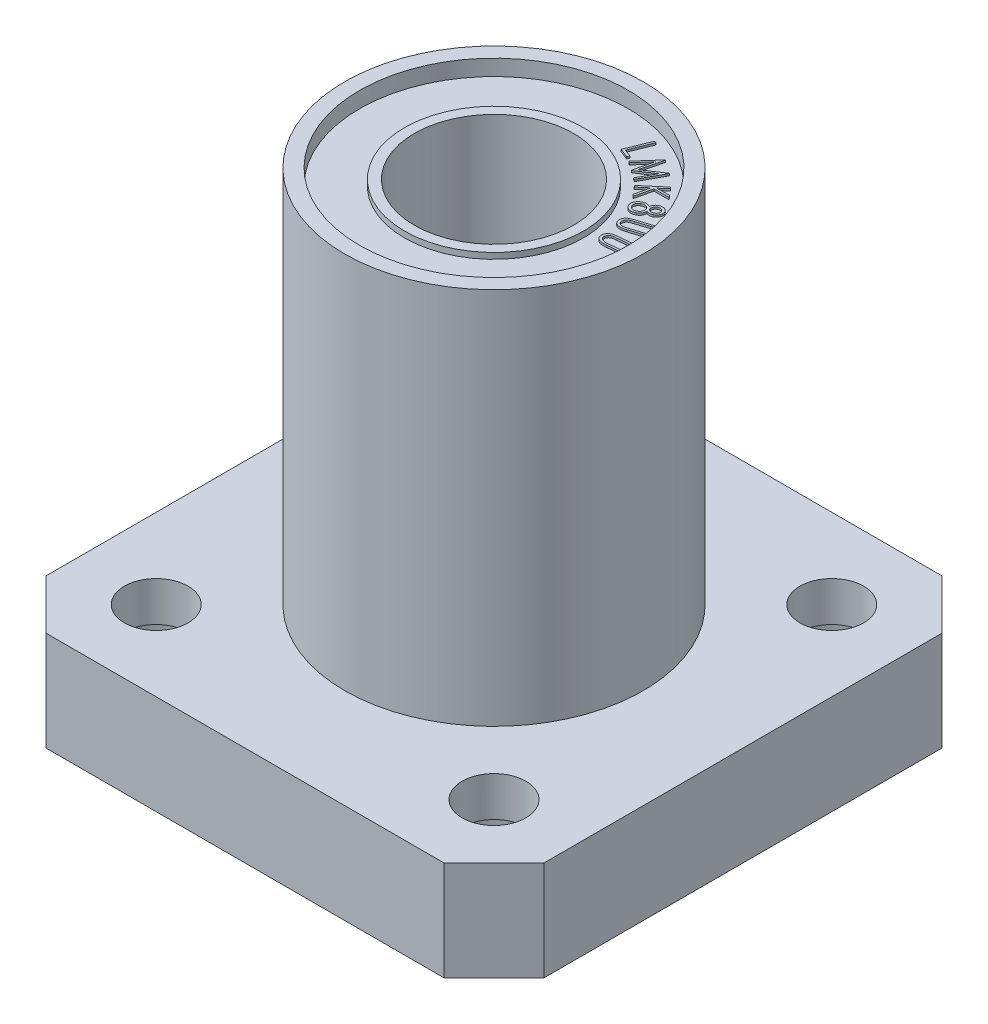
from build123d import *

# Parameters (mm, degrees)
SKETCH1_R           = 7.5
BOSS_EXTRUDE1_DEPTH = 5
SKETCH2_R           = 3
CUT_EXTRUDE1_DEPTH  = 3
CUT_EXTRUDE2_REACH  = 19.93
SKETCH3_R           = 1.6
BOSS_EXTRUDE2_DEPTH = 0.1
BOSS_EXTRUDE3_DEPTH = 0.1


with BuildPart() as part:
    # Sketch1 → Boss-Extrude1 (new body)
    with BuildSketch(Plane(origin=(0, 0, 0), x_dir=(1, 0, 0), z_dir=(0, 1, 0))):
        Polygon((-12.5, 10), (-10, 12.5), (10, 12.5), (12.5, 10), (12.5, -10), (10, -12.5), (-10, -12.5), (-12.5, -10), align=None)
        with Locations(Location((0, 0, 0), (0, 0, 270))):
            Circle(SKETCH1_R, mode=Mode.SUBTRACT)
    extrude(amount=BOSS_EXTRUDE1_DEPTH)

    # Sketch2 → Cut-Extrude1 (cut)
    with BuildSketch(Plane.XZ):
        with Locations(Location((-8.485281374, 8.485281374, 0), (0, 0, 270))):
            Circle(SKETCH2_R)
        with Locations(Location((8.485281374, 8.485281374, 0), (0, 0, 270))):
            Circle(SKETCH2_R)
        with Locations(Location((8.485281374, -8.485281374, 0), (0, 0, 270))):
            Circle(SKETCH2_R)
        with Locations(Location((-8.485281374, -8.485281374, 0), (0, 0, 270))):
            Circle(SKETCH2_R)
    extrude(amount=-CUT_EXTRUDE1_DEPTH, mode=Mode.SUBTRACT)

    # Sketch3 → Cut-Extrude2 (cut, up to next)
    with BuildSketch(Plane.XZ.offset(-3), mode=Mode.PRIVATE) as cut_extrude2_sk1:
        with Locations(Location((-8.485281374, 8.485281374, 0), (0, 0, 270))):
            Circle(SKETCH3_R)
    cut_extrude2_tool1 = extrude(cut_extrude2_sk1.sketch, amount=-CUT_EXTRUDE2_REACH, mode=Mode.PRIVATE) & part.part
    # Sketch3 → Cut-Extrude2 (cut, up to next)
    with BuildSketch(Plane.XZ.offset(-3), mode=Mode.PRIVATE) as cut_extrude2_sk2:
        with Locations(Location((8.485281374, 8.485281374, 0), (0, 0, 270))):
            Circle(SKETCH3_R)
    cut_extrude2_tool2 = extrude(cut_extrude2_sk2.sketch, amount=-CUT_EXTRUDE2_REACH, mode=Mode.PRIVATE) & part.part
    # Sketch3 → Cut-Extrude2 (cut, up to next)
    with BuildSketch(Plane.XZ.offset(-3), mode=Mode.PRIVATE) as cut_extrude2_sk3:
        with Locations(Location((8.485281374, -8.485281374, 0), (0, 0, 270))):
            Circle(SKETCH3_R)
    cut_extrude2_tool3 = extrude(cut_extrude2_sk3.sketch, amount=-CUT_EXTRUDE2_REACH, mode=Mode.PRIVATE) & part.part
    # Sketch3 → Cut-Extrude2 (cut, up to next)
    with BuildSketch(Plane.XZ.offset(-3), mode=Mode.PRIVATE) as cut_extrude2_sk4:
        with Locations(Location((-8.485281374, -8.485281374, 0), (0, 0, 270))):
            Circle(SKETCH3_R)
    cut_extrude2_tool4 = extrude(cut_extrude2_sk4.sketch, amount=-CUT_EXTRUDE2_REACH, mode=Mode.PRIVATE) & part.part
    add(cut_extrude2_tool1.solids().sort_by_distance((-8.485281, 3, 8.485281))[0], mode=Mode.SUBTRACT)
    add(cut_extrude2_tool2.solids().sort_by_distance((8.485281, 3, 8.485281))[0], mode=Mode.SUBTRACT)
    add(cut_extrude2_tool3.solids().sort_by_distance((8.485281, 3, -8.485281))[0], mode=Mode.SUBTRACT)
    add(cut_extrude2_tool4.solids().sort_by_distance((-8.485281, 3, -8.485281))[0], mode=Mode.SUBTRACT)

    # Sketch5 → Revolve1 (revolve)
    with BuildSketch(Plane.XY, mode=Mode.PRIVATE) as revolve1_sk:
        Polygon((4, 23.5), (4, 0.5), (4.5, 0.5), (4.5, 0.8), (6.75, 0.8), (6.75, 0), (7.5, 0), (7.5, 24), (6.75, 24), (6.75, 23.2), (4.5, 23.2), (4.5, 23.5), align=None)
    revolve(revolve1_sk.sketch.rotate(Axis((0, 25.2, 0), (0, -1, 0)), 90), axis=Axis((0, 25.2, 0), (0, -1, 0)))

    # Sketch7 → Boss-Extrude2 (add)
    # profile 1 of 6: a face of its own
    with BuildSketch(Plane(origin=(0, 0.8, 0), x_dir=(-1, 0, 0), z_dir=(0, -1, 0))):
        with BuildLine():
            Line((6.22084145, 0.902349941), (6.229956033, 0.801829108))
            Line((6.229956033, 0.801829108), (5.449487283, 0.730735358))
            add(Edge.make_bspline(
                [(5.449487283, 0.730735358), (5.438464185, 0.729682499), (5.417458447, 0.727676159), (5.387568956, 0.72499647), (5.361054179, 0.721856021), (5.337803578, 0.719893531), (5.317996479, 0.716952125), (5.301359475, 0.71512403), (5.28800597, 0.712986288), (5.280214442, 0.711562123), (5.276831033, 0.710943691)],
                knots=[0, 0, 0, 0, 1.528794766, 2.913288311, 4.14278235, 5.214831381, 6.133494473, 6.906463408, 7.525140423, 8, 8, 8, 8], degree=3))
            add(Edge.make_bspline(
                [(5.276831033, 0.710943691), (5.264711031, 0.708381663), (5.241251219, 0.703422532), (5.208203955, 0.692744228), (5.178478962, 0.679902443), (5.151727017, 0.66513354), (5.127990599, 0.647025429), (5.107103426, 0.625413825), (5.088487928, 0.600509362), (5.072933891, 0.572684668), (5.060523576, 0.543439113), (5.052029333, 0.513826734), (5.047772829, 0.484317373), (5.048745054, 0.464858085), (5.049226866, 0.455214524)],
                knots=[0, 0, 0, 0, 1.180771811, 2.285534731, 3.30513495, 4.265194721, 5.19239267, 6.140746146, 7.122544808, 8.149344855, 9.17330451, 10.145528868, 11.080968084, 12, 12, 12, 12], degree=3))
            add(Edge.make_bspline(
                [(5.049226866, 0.455214524), (5.050255353, 0.446995018), (5.052315784, 0.430528385), (5.060384652, 0.406799568), (5.070662854, 0.383494621), (5.084855347, 0.361578497), (5.101720542, 0.340955516), (5.121411941, 0.322431069), (5.143444309, 0.305966778), (5.167812591, 0.291470264), (5.194764277, 0.279699251), (5.223888715, 0.269653425), (5.255387476, 0.262139131), (5.277320353, 0.259109445), (5.288549783, 0.257558274)],
                knots=[0, 0, 0, 0, 0.88425557, 1.771482618, 2.669440886, 3.604911459, 4.555253855, 5.514633564, 6.490025224, 7.493715192, 8.541612283, 9.631490184, 10.787344957, 12, 12, 12, 12], degree=3))
            add(Edge.make_bspline(
                [(5.288549783, 0.257558274), (5.293234829, 0.257172074), (5.303719502, 0.256307795), (5.321100953, 0.255847477), (5.341766528, 0.256234487), (5.365641491, 0.257005327), (5.392724839, 0.258357201), (5.422946379, 0.260111912), (5.456353831, 0.262836685), (5.479696518, 0.264840827), (5.4919352, 0.265891608)],
                knots=[0, 0, 0, 0, 0.553614757, 1.238935511, 2.046705208, 2.987823637, 4.052359623, 5.240514265, 6.55318855, 8, 8, 8, 8], degree=3))
            Line((5.4919352, 0.265891608), (6.27240395, 0.336985358))
            Line((6.27240395, 0.336985358), (6.281518533, 0.236464524))
            Line((6.281518533, 0.236464524), (5.501049783, 0.165370774))
            add(Edge.make_bspline(
                [(5.501049783, 0.165370774), (5.486992499, 0.164166813), (5.45950586, 0.161812669), (5.419206301, 0.159635363), (5.380928063, 0.157813809), (5.34462415, 0.157739802), (5.310321467, 0.158113977), (5.278006974, 0.159661158), (5.247687471, 0.162258939), (5.21019085, 0.166929646), (5.16549476, 0.176508251), (5.114764546, 0.195618884), (5.066711327, 0.221224617), (5.02985678, 0.248283395), (5.002640779, 0.272770939), (4.984484349, 0.292737047), (4.968667346, 0.31401394), (4.955430457, 0.336490617), (4.944190767, 0.360100944), (4.936167199, 0.385223319), (4.929547918, 0.41135955), (4.927572793, 0.429396115), (4.926570616, 0.438547858)],
                knots=[0, 0, 0, 0, 1.186153523, 2.319322335, 3.393091263, 4.407605337, 5.371114419, 6.277183973, 7.126946973, 7.929015677, 9.453698066, 10.957130468, 12.472209898, 14.018143059, 14.787950398, 15.547447663, 16.283146828, 17.012884695, 17.737752096, 18.47630569, 19.22687838, 20, 20, 20, 20], degree=3))
            add(Edge.make_bspline(
                [(4.926570616, 0.438547858), (4.925848983, 0.448527196), (4.924425049, 0.468218529), (4.925787292, 0.497383615), (4.928552896, 0.525785045), (4.934888297, 0.553127008), (4.942711732, 0.579843745), (4.953628229, 0.605461459), (4.966585185, 0.630269743), (4.982089622, 0.653944991), (4.999339624, 0.676557973), (5.018783342, 0.697380346), (5.039680806, 0.716802903), (5.062327478, 0.734495226), (5.086699636, 0.750396929), (5.112618447, 0.764778085), (5.140162256, 0.777629328), (5.159496002, 0.784533492), (5.16927895, 0.788027024)],
                knots=[0, 0, 0, 0, 1.040328382, 2.052786645, 3.034467863, 4.005533287, 4.968623633, 5.928318322, 6.898164317, 7.877931518, 8.869950425, 9.854454241, 10.838958057, 11.836514772, 12.841285928, 13.864409115, 14.91938305, 16, 16, 16, 16], degree=3))
            add(Edge.make_bspline(
                [(5.16927895, 0.788027024), (5.176115306, 0.790185256), (5.190884015, 0.794847725), (5.215260831, 0.800694626), (5.243407834, 0.806387398), (5.275377585, 0.81179533), (5.311175206, 0.816891959), (5.350723809, 0.82225597), (5.39426294, 0.826734218), (5.424573117, 0.82970673), (5.4403727, 0.831256191)],
                knots=[0, 0, 0, 0, 0.625503873, 1.351287862, 2.186286463, 3.131603887, 4.180501471, 5.341961439, 6.614462024, 8, 8, 8, 8], degree=3))
            Line((5.4403727, 0.831256191), (6.22084145, 0.902349941))
        make_face()
    # profile 2 of 6: a face of its own
    with BuildSketch(Plane(origin=(0, 0.8, 0), x_dir=(-1, 0, 0), z_dir=(0, -1, 0))):
        with BuildLine():
            Line((5.875897339, 2.22233005), (5.906366089, 2.126496717))
            Line((5.906366089, 2.126496717), (5.162095256, 1.889257133))
            add(Edge.make_bspline(
                [(5.162095256, 1.889257133), (5.151584215, 1.88589489), (5.131582296, 1.87949673), (5.10325225, 1.870039151), (5.077937932, 1.861781254), (5.055794525, 1.854246229), (5.036896304, 1.847486676), (5.021076706, 1.84172566), (5.00847353, 1.836895099), (5.001151679, 1.83380332), (4.998032756, 1.8324863)],
                knots=[0, 0, 0, 0, 1.525191931, 2.902354534, 4.127764905, 5.205237062, 6.134916989, 6.901607016, 7.532112379, 8, 8, 8, 8], degree=3))
            add(Edge.make_bspline(
                [(4.998032756, 1.8324863), (4.986831561, 1.82737218), (4.965224289, 1.817506965), (4.935341377, 1.80026622), (4.909189053, 1.781578304), (4.88658173, 1.761271715), (4.867294208, 1.738756951), (4.851825089, 1.713193449), (4.838761568, 1.685091401), (4.829774145, 1.654515167), (4.824096487, 1.623336583), (4.82201257, 1.592632364), (4.824492636, 1.563094803), (4.829448493, 1.544325515), (4.831886923, 1.535090467)],
                knots=[0, 0, 0, 0, 1.179634477, 2.275532612, 3.300685208, 4.254852087, 5.181604681, 6.130497971, 7.109582763, 8.143910145, 9.175255446, 10.14206896, 11.085842548, 12, 12, 12, 12], degree=3))
            add(Edge.make_bspline(
                [(4.831886923, 1.535090467), (4.834679703, 1.527253185), (4.840232553, 1.511670419), (4.852986684, 1.490181983), (4.868059839, 1.469803804), (4.886628439, 1.45158872), (4.907392887, 1.4350815), (4.930471134, 1.421296052), (4.955441655, 1.409972669), (4.982383054, 1.401470718), (5.011160059, 1.395401333), (5.041706982, 1.392489698), (5.074037119, 1.391807477), (5.096045013, 1.393732162), (5.107407756, 1.394725883)],
                knots=[0, 0, 0, 0, 0.890821268, 1.771208317, 2.669159955, 3.604454335, 4.552967615, 5.509859667, 6.481196019, 7.48866292, 8.535452667, 9.631005098, 10.776880757, 12, 12, 12, 12], degree=3))
            add(Edge.make_bspline(
                [(5.107407756, 1.394725883), (5.112107419, 1.39525927), (5.122528245, 1.396441977), (5.139458316, 1.400207623), (5.159523734, 1.404378814), (5.182416624, 1.410674414), (5.208508801, 1.417596548), (5.237636264, 1.42587972), (5.269572395, 1.43592143), (5.291868968, 1.442905224), (5.303501506, 1.4465488)],
                knots=[0, 0, 0, 0, 0.558640481, 1.238704943, 2.047699153, 2.98084938, 4.043522455, 5.238550154, 6.559300155, 8, 8, 8, 8], degree=3))
            Line((5.303501506, 1.4465488), (6.047772339, 1.683788383))
            Line((6.047772339, 1.683788383), (6.078241089, 1.588215467))
            Line((6.078241089, 1.588215467), (5.333970256, 1.350975883))
            add(Edge.make_bspline(
                [(5.333970256, 1.350975883), (5.320531418, 1.346756425), (5.294248528, 1.338504257), (5.25554338, 1.327322114), (5.218492362, 1.317557063), (5.183068426, 1.309674051), (5.149540847, 1.302447722), (5.117747197, 1.296947297), (5.087674301, 1.293078487), (5.050220153, 1.289418003), (5.004724802, 1.289283173), (4.951269085, 1.296674586), (4.899145345, 1.311401079), (4.85731544, 1.32952358), (4.825713304, 1.347524946), (4.803836872, 1.363078052), (4.784048877, 1.38026508), (4.766131779, 1.399103702), (4.750494936, 1.419901712), (4.736552777, 1.442267973), (4.725137686, 1.466669715), (4.71907408, 1.483734832), (4.716001506, 1.492382133)],
                knots=[0, 0, 0, 0, 1.188199745, 2.323811327, 3.398356167, 4.419789937, 5.38488964, 6.291399462, 7.140645276, 7.942173477, 9.465298691, 10.965884116, 12.479704291, 14.02104498, 14.798529993, 15.544225714, 16.281314601, 17.006522459, 17.73294931, 18.472688755, 19.22607503, 20, 20, 20, 20], degree=3))
            add(Edge.make_bspline(
                [(4.716001506, 1.492382133), (4.713112224, 1.501969044), (4.707444669, 1.520774531), (4.702443952, 1.54943931), (4.699374332, 1.577635937), (4.699267069, 1.605610638), (4.70111265, 1.633288958), (4.70632146, 1.660515077), (4.713536463, 1.687486273), (4.7234787, 1.713949621), (4.735647782, 1.739666401), (4.750065805, 1.764149059), (4.766216734, 1.787503059), (4.784636192, 1.809432522), (4.804827771, 1.830256267), (4.827252111, 1.849597466), (4.851371535, 1.867893108), (4.86869346, 1.878792958), (4.877459839, 1.884309217)],
                knots=[0, 0, 0, 0, 1.044353835, 2.048582916, 3.032323801, 4.001981994, 4.965267775, 5.92329655, 6.890538172, 7.876904983, 8.869992292, 9.856900091, 10.839805882, 11.830658089, 12.843152904, 13.864409527, 14.919208139, 16, 16, 16, 16], degree=3))
            add(Edge.make_bspline(
                [(4.877459839, 1.884309217), (4.883588944, 1.887844491), (4.896949639, 1.895550954), (4.919343795, 1.906560891), (4.94546869, 1.918331092), (4.975454831, 1.93038441), (5.009062398, 1.943525075), (5.046535317, 1.956929135), (5.08774931, 1.971063971), (5.116591071, 1.980283996), (5.131626506, 1.985090467)],
                knots=[0, 0, 0, 0, 0.619832187, 1.351157898, 2.185222956, 3.130146418, 4.182446723, 5.346937862, 6.616938003, 8, 8, 8, 8], degree=3))
            Line((5.131626506, 1.985090467), (5.875897339, 2.22233005))
        make_face()
    # profile 3 of 6: a face of its own
    with BuildSketch(Plane(origin=(0, 0.8, 0), x_dir=(-1, 0, 0), z_dir=(0, -1, 0))):
        with BuildLine():
            add(Edge.make_bspline(
                [(5.03623582, 2.660004229), (5.034810644, 2.640495402), (5.032070242, 2.602982791), (5.020296164, 2.54959207), (5.003724531, 2.50118196), (4.980571945, 2.45812066), (4.952240996, 2.419462272), (4.918541977, 2.384836149), (4.880030786, 2.353027275), (4.851067975, 2.33559708), (4.83623582, 2.326670896)],
                knots=[0, 0, 0, 0, 1.148912268, 2.209189684, 3.205302314, 4.148436118, 5.072409288, 6.014644783, 6.983278996, 8, 8, 8, 8], degree=3))
            add(Edge.make_bspline(
                [(4.83623582, 2.326670896), (4.825456511, 2.32088647), (4.804057921, 2.309403491), (4.771100267, 2.294877397), (4.737834, 2.283092366), (4.704414366, 2.273921985), (4.670806, 2.267433955), (4.636953984, 2.263395016), (4.602887149, 2.262411052), (4.580155311, 2.26358423), (4.568787903, 2.264170896)],
                knots=[0, 0, 0, 0, 1.052842317, 2.090054439, 3.096914797, 4.088546547, 5.070472966, 6.040958631, 7.020351043, 8, 8, 8, 8], degree=3))
            add(Edge.make_bspline(
                [(4.568787903, 2.264170896), (4.555183505, 2.265637751), (4.528540204, 2.26851049), (4.490236256, 2.27880957), (4.454178982, 2.292572047), (4.421250646, 2.311846386), (4.390258409, 2.334474365), (4.36251715, 2.362298595), (4.33655309, 2.393782821), (4.322389051, 2.417606561), (4.31514207, 2.429795896)],
                knots=[0, 0, 0, 0, 1.036248287, 2.029422864, 2.998858943, 3.954222451, 4.914066478, 5.900981259, 6.926044263, 8, 8, 8, 8], degree=3))
            add(Edge.make_bspline(
                [(4.31514207, 2.429795896), (4.308715558, 2.441910352), (4.296233204, 2.465440525), (4.282319126, 2.501969584), (4.273155726, 2.53807219), (4.268237545, 2.57382092), (4.268334156, 2.609278065), (4.272744649, 2.644471216), (4.281906995, 2.679340668), (4.296002607, 2.713188089), (4.31278608, 2.745933257), (4.331811663, 2.777048802), (4.353036504, 2.806087032), (4.376207048, 2.833148739), (4.40127539, 2.85833793), (4.428567897, 2.881260474), (4.457634232, 2.902487652), (4.478403537, 2.91476995), (4.488839986, 2.920941729)],
                knots=[0, 0, 0, 0, 1.12686841, 2.188741134, 3.204984959, 4.184230422, 5.147871993, 6.112042166, 7.093730095, 8.102450464, 9.120822918, 10.117346724, 11.098203858, 12.0752876, 13.044386251, 14.016844007, 15.003476194, 16, 16, 16, 16], degree=3))
            add(Edge.make_bspline(
                [(4.488839986, 2.920941729), (4.504465194, 2.929129175), (4.535061547, 2.945161344), (4.583185791, 2.962466036), (4.631755081, 2.973239198), (4.67270441, 2.977037365), (4.705634364, 2.976703635), (4.730802962, 2.974634443), (4.756317699, 2.970456803), (4.782194657, 2.964067514), (4.808531869, 2.955963494), (4.835433328, 2.946058218), (4.862715969, 2.934094207), (4.880726581, 2.924856267), (4.889881653, 2.920160479)],
                knots=[0, 0, 0, 0, 1.507774505, 2.952434298, 4.359598713, 5.754007683, 6.45952714, 7.17490471, 7.912299031, 8.668778663, 9.453349823, 10.268633804, 11.119919897, 12, 12, 12, 12], degree=3))
            add(Edge.make_bspline(
                [(4.889881653, 2.920160479), (4.891318665, 2.934633538), (4.894138785, 2.963036755), (4.904900056, 3.003946751), (4.919953058, 3.042385607), (4.9401818, 3.077966132), (4.964747817, 3.110307673), (4.992430769, 3.139863925), (5.023993573, 3.165613545), (5.047174149, 3.1798772), (5.05889207, 3.187087563)],
                knots=[0, 0, 0, 0, 1.057604441, 2.075537024, 3.068516095, 4.05635199, 5.044915603, 6.019621161, 6.998906665, 8, 8, 8, 8], degree=3))
            add(Edge.make_bspline(
                [(5.05889207, 3.187087563), (5.071343698, 3.193466157), (5.096244073, 3.206221868), (5.136257039, 3.219996105), (5.178224763, 3.229060104), (5.221522084, 3.233708571), (5.265074483, 3.23364889), (5.307356174, 3.227903661), (5.347914065, 3.216923042), (5.385951059, 3.200222995), (5.421092781, 3.178955139), (5.452439529, 3.153521931), (5.479572874, 3.123871892), (5.493529178, 3.101140934), (5.500558736, 3.089691729)],
                knots=[0, 0, 0, 0, 1.004548173, 2.00886383, 3.030699952, 4.084842225, 5.133004105, 6.152991059, 7.14286268, 8.143139466, 9.128597098, 10.086433144, 11.036168305, 12, 12, 12, 12], degree=3))
            add(Edge.make_bspline(
                [(5.500558736, 3.089691729), (5.506525021, 3.078056222), (5.518358125, 3.054979188), (5.528864415, 3.017256556), (5.533873796, 2.978214847), (5.532883929, 2.938073504), (5.52684857, 2.897783985), (5.514507127, 2.858393157), (5.49721647, 2.820020856), (5.474583281, 2.783457334), (5.447931881, 2.749144633), (5.41750065, 2.718357627), (5.384062067, 2.690789853), (5.359354244, 2.675856887), (5.346912903, 2.668337563)],
                knots=[0, 0, 0, 0, 0.945352338, 1.874944359, 2.819668819, 3.788436124, 4.774926252, 5.76171708, 6.769451784, 7.816857136, 8.86991237, 9.910630415, 10.947921905, 12, 12, 12, 12], degree=3))
            add(Edge.make_bspline(
                [(5.346912903, 2.668337563), (5.334301419, 2.661672185), (5.309610511, 2.648622631), (5.270729222, 2.63496993), (5.231891133, 2.625804654), (5.19281449, 2.622163693), (5.153573509, 2.623728151), (5.114345766, 2.630717589), (5.074752854, 2.64242438), (5.049304353, 2.654039522), (5.03623582, 2.660004229)],
                knots=[0, 0, 0, 0, 1.05368983, 2.062926098, 3.037825414, 3.998607814, 4.955952238, 5.933300523, 6.938690664, 8, 8, 8, 8], degree=3))
        make_face()
        with BuildLine():
            add(Edge.make_bspline(
                [(5.388839986, 3.032139646), (5.385299036, 3.038022093), (5.378372593, 3.04952873), (5.36633946, 3.065429433), (5.352603668, 3.079098063), (5.338118151, 3.091718127), (5.321646971, 3.101582908), (5.304566428, 3.110775357), (5.285796475, 3.117366138), (5.259662868, 3.124293381), (5.225999742, 3.128460407), (5.18557819, 3.125762196), (5.145768542, 3.115639449), (5.121191006, 3.103120355), (5.108631653, 3.096722979)],
                knots=[0, 0, 0, 0, 0.771371265, 1.508876917, 2.233168167, 2.946338218, 3.660841298, 4.385066856, 5.122637017, 5.889244203, 7.422241339, 8.908179276, 10.420050441, 12, 12, 12, 12], degree=3))
            add(Edge.make_bspline(
                [(5.108631653, 3.096722979), (5.096629984, 3.089297696), (5.072839874, 3.074579049), (5.043586106, 3.044008908), (5.018751265, 3.009074614), (5.003911608, 2.97573274), (4.994866349, 2.947931403), (4.990156268, 2.927194385), (4.987307294, 2.906963249), (4.987569684, 2.887221647), (4.989147241, 2.868052215), (4.993509845, 2.849486056), (4.99962067, 2.831280652), (5.005605964, 2.819915975), (5.008631653, 2.814170896)],
                knots=[0, 0, 0, 0, 1.533588379, 3.039930189, 4.576467526, 6.190619256, 6.996055201, 7.763185412, 8.507722715, 9.217812041, 9.91213595, 10.601211289, 11.292883492, 12, 12, 12, 12], degree=3))
            add(Edge.make_bspline(
                [(5.008631653, 2.814170896), (5.013065488, 2.807030753), (5.021885548, 2.792827138), (5.039770314, 2.774868392), (5.059763342, 2.758640561), (5.083164683, 2.745874314), (5.108347036, 2.735613189), (5.135431437, 2.729452355), (5.163686495, 2.726513078), (5.192868385, 2.727518705), (5.221949365, 2.731267247), (5.249976654, 2.738221574), (5.276727891, 2.747271939), (5.293191715, 2.75596318), (5.301339986, 2.760264646)],
                knots=[0, 0, 0, 0, 0.917455116, 1.825058412, 2.758815138, 3.729157038, 4.731739484, 5.727766818, 6.759660326, 7.834148225, 8.917679667, 9.96435252, 10.992517998, 12, 12, 12, 12], degree=3))
            add(Edge.make_bspline(
                [(5.301339986, 2.760264646), (5.312223508, 2.766996066), (5.33389392, 2.78039914), (5.36125839, 2.807491116), (5.38486426, 2.838435395), (5.399994142, 2.867835987), (5.409569547, 2.892772883), (5.413942158, 2.912248383), (5.416049118, 2.931821999), (5.41581917, 2.951682774), (5.412935005, 2.971730838), (5.407313715, 2.99185303), (5.399451801, 3.012226042), (5.392457767, 3.025350699), (5.388839986, 3.032139646)],
                knots=[0, 0, 0, 0, 1.437759673, 2.86275386, 4.30837682, 5.808940969, 6.570219614, 7.31286018, 8.05058939, 8.78422242, 9.544998239, 10.325634515, 11.133906579, 12, 12, 12, 12], degree=3))
        make_face(mode=Mode.SUBTRACT)
        with BuildLine():
            add(Edge.make_bspline(
                [(4.907589986, 2.755577146), (4.903157587, 2.762981849), (4.894438977, 2.777547033), (4.878629504, 2.797180002), (4.861017149, 2.814508371), (4.841683656, 2.829714063), (4.820375354, 2.842639525), (4.797089274, 2.85287986), (4.772208553, 2.861366487), (4.745817362, 2.867175232), (4.718719474, 2.870787478), (4.691537353, 2.872112213), (4.664694834, 2.871094627), (4.638122707, 2.867646566), (4.611885529, 2.861942372), (4.585882016, 2.85383383), (4.560352672, 2.843073421), (4.543816595, 2.834428108), (4.53545457, 2.830056313)],
                knots=[0, 0, 0, 0, 0.982504826, 1.932604863, 2.862930666, 3.792993479, 4.729452154, 5.694674639, 6.686299875, 7.720622017, 8.7684788, 9.798439894, 10.818088704, 11.82542742, 12.847951186, 13.874152677, 14.924993485, 16, 16, 16, 16], degree=3))
            add(Edge.make_bspline(
                [(4.53545457, 2.830056313), (4.525410624, 2.823938454), (4.505551989, 2.811842378), (4.478429222, 2.789894954), (4.454252767, 2.765006786), (4.432663124, 2.737967982), (4.414948302, 2.708968934), (4.401730139, 2.678642488), (4.393018906, 2.647452314), (4.389033291, 2.615499786), (4.390142734, 2.583268333), (4.396065147, 2.551140401), (4.406321527, 2.519064576), (4.416990683, 2.498924744), (4.422433736, 2.488650063)],
                knots=[0, 0, 0, 0, 1.050454387, 2.076931838, 3.108558678, 4.147166269, 5.163918326, 6.13700278, 7.095277716, 8.049112307, 9.004082566, 9.966057782, 10.962349478, 12, 12, 12, 12], degree=3))
            add(Edge.make_bspline(
                [(4.422433736, 2.488650063), (4.427160858, 2.480923795), (4.436411282, 2.465804393), (4.452321918, 2.444989407), (4.470121236, 2.427041899), (4.489352018, 2.411379277), (4.510201894, 2.398418937), (4.53261272, 2.387771421), (4.556659257, 2.380152881), (4.581846155, 2.374589096), (4.607784266, 2.371968853), (4.633736178, 2.371015744), (4.659514466, 2.372732918), (4.684988809, 2.37623894), (4.710245708, 2.382365567), (4.735133107, 2.390698955), (4.759847344, 2.401192571), (4.775790437, 2.409625306), (4.78389207, 2.413910479)],
                knots=[0, 0, 0, 0, 1.053215978, 2.061020401, 3.039203443, 3.986947229, 4.939519631, 5.888069893, 6.865157925, 7.867281102, 8.883096294, 9.893275294, 10.884658387, 11.884234868, 12.881002469, 13.902772051, 14.934273937, 16, 16, 16, 16], degree=3))
            add(Edge.make_bspline(
                [(4.78389207, 2.413910479), (4.791522303, 2.418476482), (4.806559736, 2.427475022), (4.827627962, 2.443006359), (4.846793147, 2.460186755), (4.864428817, 2.478732306), (4.880074666, 2.498969383), (4.894154685, 2.520539673), (4.906481884, 2.543735891), (4.91704521, 2.568084777), (4.925280228, 2.593109521), (4.931162577, 2.617836632), (4.934046992, 2.642127288), (4.934323094, 2.665874025), (4.932053332, 2.689237489), (4.926760963, 2.712058581), (4.918675676, 2.734351282), (4.911313341, 2.748448008), (4.907589986, 2.755577146)],
                knots=[0, 0, 0, 0, 1.061417744, 2.091809977, 3.119644169, 4.131569755, 5.143442247, 6.169864184, 7.204003688, 8.276549239, 9.33533168, 10.346141727, 11.306586232, 12.249929467, 13.177189198, 14.102534959, 15.040394922, 16, 16, 16, 16], degree=3))
        make_face(mode=Mode.SUBTRACT)
    # profile 4 of 6: a face of its own
    with BuildSketch(Plane(origin=(0, 0.8, 0), x_dir=(-1, 0, 0), z_dir=(0, -1, 0))):
        Polygon((4.57383865, 4.29708848), (4.639984483, 4.21896348), (4.271755317, 3.90646348), (4.899099067, 3.913234314), (4.9871199, 3.80958848), (4.234515733, 3.804380147), (4.029828233, 2.948390564), (3.943890733, 3.049953064), (4.116286567, 3.774692647), (3.658474067, 3.386411397), (3.592328233, 3.464536397), align=None)
    # profile 5 of 6: a face of its own
    with BuildSketch(Plane(origin=(0, 0.8, 0), x_dir=(-1, 0, 0), z_dir=(0, -1, 0))):
        Polygon((2.393817974, 4.378423393), (3.266213808, 5.348735893), (3.279495058, 5.339100476), (2.989651308, 4.237017143), (3.938088808, 4.865923393), (3.951370058, 4.856548393), (3.311265891, 3.71930881), (3.231057558, 3.776860893), (3.692776308, 4.587537976), (2.863609641, 4.040923393), (2.843297141, 4.055506726), (3.096942974, 5.024256726), (2.472463808, 4.321912976), align=None)
    # profile 6 of 6: a face of its own
    with BuildSketch(Plane(origin=(0, 0.8, 0), x_dir=(-1, 0, 0), z_dir=(0, -1, 0))):
        Polygon((2.18878182, 5.894599264), (2.282792237, 5.855536764), (1.83253182, 4.774026348), (2.19112557, 4.624807598), (2.142948487, 4.509182598), (1.69034432, 4.697463848), align=None)
    extrude(amount=BOSS_EXTRUDE2_DEPTH)

    # Sketch8 → Boss-Extrude3 (add)
    # profile 1 of 6: a face of its own
    with BuildSketch(Plane(origin=(0, 23.2, 0), x_dir=(1, 0, 0), z_dir=(0, 1, 0))):
        with BuildLine():
            Line((6.22084145, 0.902349941), (6.229956033, 0.801829108))
            Line((6.229956033, 0.801829108), (5.449487283, 0.730735358))
            add(Edge.make_bspline(
                [(5.449487283, 0.730735358), (5.438464185, 0.729682499), (5.417458447, 0.727676159), (5.387568956, 0.72499647), (5.361054179, 0.721856021), (5.337803578, 0.719893531), (5.317996479, 0.716952125), (5.301359475, 0.71512403), (5.28800597, 0.712986288), (5.280214442, 0.711562123), (5.276831033, 0.710943691)],
                knots=[0, 0, 0, 0, 1.528794766, 2.913288311, 4.14278235, 5.214831381, 6.133494473, 6.906463408, 7.525140423, 8, 8, 8, 8], degree=3))
            add(Edge.make_bspline(
                [(5.276831033, 0.710943691), (5.264711031, 0.708381663), (5.241251219, 0.703422532), (5.208203955, 0.692744228), (5.178478962, 0.679902443), (5.151727017, 0.66513354), (5.127990599, 0.647025429), (5.107103426, 0.625413825), (5.088487928, 0.600509362), (5.072933891, 0.572684668), (5.060523576, 0.543439113), (5.052029333, 0.513826734), (5.047772829, 0.484317373), (5.048745054, 0.464858085), (5.049226866, 0.455214524)],
                knots=[0, 0, 0, 0, 1.180771811, 2.285534731, 3.30513495, 4.265194721, 5.19239267, 6.140746146, 7.122544808, 8.149344855, 9.17330451, 10.145528868, 11.080968084, 12, 12, 12, 12], degree=3))
            add(Edge.make_bspline(
                [(5.049226866, 0.455214524), (5.050255353, 0.446995018), (5.052315784, 0.430528385), (5.060384652, 0.406799568), (5.070662854, 0.383494621), (5.084855347, 0.361578497), (5.101720542, 0.340955516), (5.121411941, 0.322431069), (5.143444309, 0.305966778), (5.167812591, 0.291470264), (5.194764277, 0.279699251), (5.223888715, 0.269653425), (5.255387476, 0.262139131), (5.277320353, 0.259109445), (5.288549783, 0.257558274)],
                knots=[0, 0, 0, 0, 0.88425557, 1.771482618, 2.669440886, 3.604911459, 4.555253855, 5.514633564, 6.490025224, 7.493715192, 8.541612283, 9.631490184, 10.787344957, 12, 12, 12, 12], degree=3))
            add(Edge.make_bspline(
                [(5.288549783, 0.257558274), (5.293234829, 0.257172074), (5.303719502, 0.256307795), (5.321100953, 0.255847477), (5.341766528, 0.256234487), (5.365641491, 0.257005327), (5.392724839, 0.258357201), (5.422946379, 0.260111912), (5.456353831, 0.262836685), (5.479696518, 0.264840827), (5.4919352, 0.265891608)],
                knots=[0, 0, 0, 0, 0.553614757, 1.238935511, 2.046705208, 2.987823637, 4.052359623, 5.240514265, 6.55318855, 8, 8, 8, 8], degree=3))
            Line((5.4919352, 0.265891608), (6.27240395, 0.336985358))
            Line((6.27240395, 0.336985358), (6.281518533, 0.236464524))
            Line((6.281518533, 0.236464524), (5.501049783, 0.165370774))
            add(Edge.make_bspline(
                [(5.501049783, 0.165370774), (5.486992499, 0.164166813), (5.45950586, 0.161812669), (5.419206301, 0.159635363), (5.380928063, 0.157813809), (5.34462415, 0.157739802), (5.310321467, 0.158113977), (5.278006974, 0.159661158), (5.247687471, 0.162258939), (5.21019085, 0.166929646), (5.16549476, 0.176508251), (5.114764546, 0.195618884), (5.066711327, 0.221224617), (5.02985678, 0.248283395), (5.002640779, 0.272770939), (4.984484349, 0.292737047), (4.968667346, 0.31401394), (4.955430457, 0.336490617), (4.944190767, 0.360100944), (4.936167199, 0.385223319), (4.929547918, 0.41135955), (4.927572793, 0.429396115), (4.926570616, 0.438547858)],
                knots=[0, 0, 0, 0, 1.186153523, 2.319322335, 3.393091263, 4.407605337, 5.371114419, 6.277183973, 7.126946973, 7.929015677, 9.453698066, 10.957130468, 12.472209898, 14.018143059, 14.787950398, 15.547447663, 16.283146828, 17.012884695, 17.737752096, 18.47630569, 19.22687838, 20, 20, 20, 20], degree=3))
            add(Edge.make_bspline(
                [(4.926570616, 0.438547858), (4.925848983, 0.448527196), (4.924425049, 0.468218529), (4.925787292, 0.497383615), (4.928552896, 0.525785045), (4.934888297, 0.553127008), (4.942711732, 0.579843745), (4.953628229, 0.605461459), (4.966585185, 0.630269743), (4.982089622, 0.653944991), (4.999339624, 0.676557973), (5.018783342, 0.697380346), (5.039680806, 0.716802903), (5.062327478, 0.734495226), (5.086699636, 0.750396929), (5.112618447, 0.764778085), (5.140162256, 0.777629328), (5.159496002, 0.784533492), (5.16927895, 0.788027024)],
                knots=[0, 0, 0, 0, 1.040328382, 2.052786645, 3.034467863, 4.005533287, 4.968623633, 5.928318322, 6.898164317, 7.877931518, 8.869950425, 9.854454241, 10.838958057, 11.836514772, 12.841285928, 13.864409115, 14.91938305, 16, 16, 16, 16], degree=3))
            add(Edge.make_bspline(
                [(5.16927895, 0.788027024), (5.176115306, 0.790185256), (5.190884015, 0.794847725), (5.215260831, 0.800694626), (5.243407834, 0.806387398), (5.275377585, 0.81179533), (5.311175206, 0.816891959), (5.350723809, 0.82225597), (5.39426294, 0.826734218), (5.424573117, 0.82970673), (5.4403727, 0.831256191)],
                knots=[0, 0, 0, 0, 0.625503873, 1.351287862, 2.186286463, 3.131603887, 4.180501471, 5.341961439, 6.614462024, 8, 8, 8, 8], degree=3))
            Line((5.4403727, 0.831256191), (6.22084145, 0.902349941))
        make_face()
    # profile 2 of 6: a face of its own
    with BuildSketch(Plane(origin=(0, 23.2, 0), x_dir=(1, 0, 0), z_dir=(0, 1, 0))):
        with BuildLine():
            Line((5.875897339, 2.22233005), (5.906366089, 2.126496717))
            Line((5.906366089, 2.126496717), (5.162095256, 1.889257133))
            add(Edge.make_bspline(
                [(5.162095256, 1.889257133), (5.151584215, 1.88589489), (5.131582296, 1.87949673), (5.10325225, 1.870039151), (5.077937932, 1.861781254), (5.055794525, 1.854246229), (5.036896304, 1.847486676), (5.021076706, 1.84172566), (5.00847353, 1.836895099), (5.001151679, 1.83380332), (4.998032756, 1.8324863)],
                knots=[0, 0, 0, 0, 1.525191931, 2.902354534, 4.127764905, 5.205237062, 6.134916989, 6.901607016, 7.532112379, 8, 8, 8, 8], degree=3))
            add(Edge.make_bspline(
                [(4.998032756, 1.8324863), (4.986831561, 1.82737218), (4.965224289, 1.817506965), (4.935341377, 1.80026622), (4.909189053, 1.781578304), (4.88658173, 1.761271715), (4.867294208, 1.738756951), (4.851825089, 1.713193449), (4.838761568, 1.685091401), (4.829774145, 1.654515167), (4.824096487, 1.623336583), (4.82201257, 1.592632364), (4.824492636, 1.563094803), (4.829448493, 1.544325515), (4.831886923, 1.535090467)],
                knots=[0, 0, 0, 0, 1.179634477, 2.275532612, 3.300685208, 4.254852087, 5.181604681, 6.130497971, 7.109582763, 8.143910145, 9.175255446, 10.14206896, 11.085842548, 12, 12, 12, 12], degree=3))
            add(Edge.make_bspline(
                [(4.831886923, 1.535090467), (4.834679703, 1.527253185), (4.840232553, 1.511670419), (4.852986684, 1.490181983), (4.868059839, 1.469803804), (4.886628439, 1.45158872), (4.907392887, 1.4350815), (4.930471134, 1.421296052), (4.955441655, 1.409972669), (4.982383054, 1.401470718), (5.011160059, 1.395401333), (5.041706982, 1.392489698), (5.074037119, 1.391807477), (5.096045013, 1.393732162), (5.107407756, 1.394725883)],
                knots=[0, 0, 0, 0, 0.890821268, 1.771208317, 2.669159955, 3.604454335, 4.552967615, 5.509859667, 6.481196019, 7.48866292, 8.535452667, 9.631005098, 10.776880757, 12, 12, 12, 12], degree=3))
            add(Edge.make_bspline(
                [(5.107407756, 1.394725883), (5.112107419, 1.39525927), (5.122528245, 1.396441977), (5.139458316, 1.400207623), (5.159523734, 1.404378814), (5.182416624, 1.410674414), (5.208508801, 1.417596548), (5.237636264, 1.42587972), (5.269572395, 1.43592143), (5.291868968, 1.442905224), (5.303501506, 1.4465488)],
                knots=[0, 0, 0, 0, 0.558640481, 1.238704943, 2.047699153, 2.98084938, 4.043522455, 5.238550154, 6.559300155, 8, 8, 8, 8], degree=3))
            Line((5.303501506, 1.4465488), (6.047772339, 1.683788383))
            Line((6.047772339, 1.683788383), (6.078241089, 1.588215467))
            Line((6.078241089, 1.588215467), (5.333970256, 1.350975883))
            add(Edge.make_bspline(
                [(5.333970256, 1.350975883), (5.320531418, 1.346756425), (5.294248528, 1.338504257), (5.25554338, 1.327322114), (5.218492362, 1.317557063), (5.183068426, 1.309674051), (5.149540847, 1.302447722), (5.117747197, 1.296947297), (5.087674301, 1.293078487), (5.050220153, 1.289418003), (5.004724802, 1.289283173), (4.951269085, 1.296674586), (4.899145345, 1.311401079), (4.85731544, 1.32952358), (4.825713304, 1.347524946), (4.803836872, 1.363078052), (4.784048877, 1.38026508), (4.766131779, 1.399103702), (4.750494936, 1.419901712), (4.736552777, 1.442267973), (4.725137686, 1.466669715), (4.71907408, 1.483734832), (4.716001506, 1.492382133)],
                knots=[0, 0, 0, 0, 1.188199745, 2.323811327, 3.398356167, 4.419789937, 5.38488964, 6.291399462, 7.140645276, 7.942173477, 9.465298691, 10.965884116, 12.479704291, 14.02104498, 14.798529993, 15.544225714, 16.281314601, 17.006522459, 17.73294931, 18.472688755, 19.22607503, 20, 20, 20, 20], degree=3))
            add(Edge.make_bspline(
                [(4.716001506, 1.492382133), (4.713112224, 1.501969044), (4.707444669, 1.520774531), (4.702443952, 1.54943931), (4.699374332, 1.577635937), (4.699267069, 1.605610638), (4.70111265, 1.633288958), (4.70632146, 1.660515077), (4.713536463, 1.687486273), (4.7234787, 1.713949621), (4.735647782, 1.739666401), (4.750065805, 1.764149059), (4.766216734, 1.787503059), (4.784636192, 1.809432522), (4.804827771, 1.830256267), (4.827252111, 1.849597466), (4.851371535, 1.867893108), (4.86869346, 1.878792958), (4.877459839, 1.884309217)],
                knots=[0, 0, 0, 0, 1.044353835, 2.048582916, 3.032323801, 4.001981994, 4.965267775, 5.92329655, 6.890538172, 7.876904983, 8.869992292, 9.856900091, 10.839805882, 11.830658089, 12.843152904, 13.864409527, 14.919208139, 16, 16, 16, 16], degree=3))
            add(Edge.make_bspline(
                [(4.877459839, 1.884309217), (4.883588944, 1.887844491), (4.896949639, 1.895550954), (4.919343795, 1.906560891), (4.94546869, 1.918331092), (4.975454831, 1.93038441), (5.009062398, 1.943525075), (5.046535317, 1.956929135), (5.08774931, 1.971063971), (5.116591071, 1.980283996), (5.131626506, 1.985090467)],
                knots=[0, 0, 0, 0, 0.619832187, 1.351157898, 2.185222956, 3.130146418, 4.182446723, 5.346937862, 6.616938003, 8, 8, 8, 8], degree=3))
            Line((5.131626506, 1.985090467), (5.875897339, 2.22233005))
        make_face()
    # profile 3 of 6: a face of its own
    with BuildSketch(Plane(origin=(0, 23.2, 0), x_dir=(1, 0, 0), z_dir=(0, 1, 0))):
        with BuildLine():
            add(Edge.make_bspline(
                [(5.03623582, 2.660004229), (5.034810644, 2.640495402), (5.032070242, 2.602982791), (5.020296164, 2.54959207), (5.003724531, 2.50118196), (4.980571945, 2.45812066), (4.952240996, 2.419462272), (4.918541977, 2.384836149), (4.880030786, 2.353027275), (4.851067975, 2.33559708), (4.83623582, 2.326670896)],
                knots=[0, 0, 0, 0, 1.148912268, 2.209189684, 3.205302314, 4.148436118, 5.072409288, 6.014644783, 6.983278996, 8, 8, 8, 8], degree=3))
            add(Edge.make_bspline(
                [(4.83623582, 2.326670896), (4.825456511, 2.32088647), (4.804057921, 2.309403491), (4.771100267, 2.294877397), (4.737834, 2.283092366), (4.704414366, 2.273921985), (4.670806, 2.267433955), (4.636953984, 2.263395016), (4.602887149, 2.262411052), (4.580155311, 2.26358423), (4.568787903, 2.264170896)],
                knots=[0, 0, 0, 0, 1.052842317, 2.090054439, 3.096914797, 4.088546547, 5.070472966, 6.040958631, 7.020351043, 8, 8, 8, 8], degree=3))
            add(Edge.make_bspline(
                [(4.568787903, 2.264170896), (4.555183505, 2.265637751), (4.528540204, 2.26851049), (4.490236256, 2.27880957), (4.454178982, 2.292572047), (4.421250646, 2.311846386), (4.390258409, 2.334474365), (4.36251715, 2.362298595), (4.33655309, 2.393782821), (4.322389051, 2.417606561), (4.31514207, 2.429795896)],
                knots=[0, 0, 0, 0, 1.036248287, 2.029422864, 2.998858943, 3.954222451, 4.914066478, 5.900981259, 6.926044263, 8, 8, 8, 8], degree=3))
            add(Edge.make_bspline(
                [(4.31514207, 2.429795896), (4.308715558, 2.441910352), (4.296233204, 2.465440525), (4.282319126, 2.501969584), (4.273155726, 2.53807219), (4.268237545, 2.57382092), (4.268334156, 2.609278065), (4.272744649, 2.644471216), (4.281906995, 2.679340668), (4.296002607, 2.713188089), (4.31278608, 2.745933257), (4.331811663, 2.777048802), (4.353036504, 2.806087032), (4.376207048, 2.833148739), (4.40127539, 2.85833793), (4.428567897, 2.881260474), (4.457634232, 2.902487652), (4.478403537, 2.91476995), (4.488839986, 2.920941729)],
                knots=[0, 0, 0, 0, 1.12686841, 2.188741134, 3.204984959, 4.184230422, 5.147871993, 6.112042166, 7.093730095, 8.102450464, 9.120822918, 10.117346724, 11.098203858, 12.0752876, 13.044386251, 14.016844007, 15.003476194, 16, 16, 16, 16], degree=3))
            add(Edge.make_bspline(
                [(4.488839986, 2.920941729), (4.504465194, 2.929129175), (4.535061547, 2.945161344), (4.583185791, 2.962466036), (4.631755081, 2.973239198), (4.67270441, 2.977037365), (4.705634364, 2.976703635), (4.730802962, 2.974634443), (4.756317699, 2.970456803), (4.782194657, 2.964067514), (4.808531869, 2.955963494), (4.835433328, 2.946058218), (4.862715969, 2.934094207), (4.880726581, 2.924856267), (4.889881653, 2.920160479)],
                knots=[0, 0, 0, 0, 1.507774505, 2.952434298, 4.359598713, 5.754007683, 6.45952714, 7.17490471, 7.912299031, 8.668778663, 9.453349823, 10.268633804, 11.119919897, 12, 12, 12, 12], degree=3))
            add(Edge.make_bspline(
                [(4.889881653, 2.920160479), (4.891318665, 2.934633538), (4.894138785, 2.963036755), (4.904900056, 3.003946751), (4.919953058, 3.042385607), (4.9401818, 3.077966132), (4.964747817, 3.110307673), (4.992430769, 3.139863925), (5.023993573, 3.165613545), (5.047174149, 3.1798772), (5.05889207, 3.187087563)],
                knots=[0, 0, 0, 0, 1.057604441, 2.075537024, 3.068516095, 4.05635199, 5.044915603, 6.019621161, 6.998906665, 8, 8, 8, 8], degree=3))
            add(Edge.make_bspline(
                [(5.05889207, 3.187087563), (5.071343698, 3.193466157), (5.096244073, 3.206221868), (5.136257039, 3.219996105), (5.178224763, 3.229060104), (5.221522084, 3.233708571), (5.265074483, 3.23364889), (5.307356174, 3.227903661), (5.347914065, 3.216923042), (5.385951059, 3.200222995), (5.421092781, 3.178955139), (5.452439529, 3.153521931), (5.479572874, 3.123871892), (5.493529178, 3.101140934), (5.500558736, 3.089691729)],
                knots=[0, 0, 0, 0, 1.004548173, 2.00886383, 3.030699952, 4.084842225, 5.133004105, 6.152991059, 7.14286268, 8.143139466, 9.128597098, 10.086433144, 11.036168305, 12, 12, 12, 12], degree=3))
            add(Edge.make_bspline(
                [(5.500558736, 3.089691729), (5.506525021, 3.078056222), (5.518358125, 3.054979188), (5.528864415, 3.017256556), (5.533873796, 2.978214847), (5.532883929, 2.938073504), (5.52684857, 2.897783985), (5.514507127, 2.858393157), (5.49721647, 2.820020856), (5.474583281, 2.783457334), (5.447931881, 2.749144633), (5.41750065, 2.718357627), (5.384062067, 2.690789853), (5.359354244, 2.675856887), (5.346912903, 2.668337563)],
                knots=[0, 0, 0, 0, 0.945352338, 1.874944359, 2.819668819, 3.788436124, 4.774926252, 5.76171708, 6.769451784, 7.816857136, 8.86991237, 9.910630415, 10.947921905, 12, 12, 12, 12], degree=3))
            add(Edge.make_bspline(
                [(5.346912903, 2.668337563), (5.334301419, 2.661672185), (5.309610511, 2.648622631), (5.270729222, 2.63496993), (5.231891133, 2.625804654), (5.19281449, 2.622163693), (5.153573509, 2.623728151), (5.114345766, 2.630717589), (5.074752854, 2.64242438), (5.049304353, 2.654039522), (5.03623582, 2.660004229)],
                knots=[0, 0, 0, 0, 1.05368983, 2.062926098, 3.037825414, 3.998607814, 4.955952238, 5.933300523, 6.938690664, 8, 8, 8, 8], degree=3))
        make_face()
        with BuildLine():
            add(Edge.make_bspline(
                [(5.388839986, 3.032139646), (5.385299036, 3.038022093), (5.378372593, 3.04952873), (5.36633946, 3.065429433), (5.352603668, 3.079098063), (5.338118151, 3.091718127), (5.321646971, 3.101582908), (5.304566428, 3.110775357), (5.285796475, 3.117366138), (5.259662868, 3.124293381), (5.225999742, 3.128460407), (5.18557819, 3.125762196), (5.145768542, 3.115639449), (5.121191006, 3.103120355), (5.108631653, 3.096722979)],
                knots=[0, 0, 0, 0, 0.771371265, 1.508876917, 2.233168167, 2.946338218, 3.660841298, 4.385066856, 5.122637017, 5.889244203, 7.422241339, 8.908179276, 10.420050441, 12, 12, 12, 12], degree=3))
            add(Edge.make_bspline(
                [(5.108631653, 3.096722979), (5.096629984, 3.089297696), (5.072839874, 3.074579049), (5.043586106, 3.044008908), (5.018751265, 3.009074614), (5.003911608, 2.97573274), (4.994866349, 2.947931403), (4.990156268, 2.927194385), (4.987307294, 2.906963249), (4.987569684, 2.887221647), (4.989147241, 2.868052215), (4.993509845, 2.849486056), (4.99962067, 2.831280652), (5.005605964, 2.819915975), (5.008631653, 2.814170896)],
                knots=[0, 0, 0, 0, 1.533588379, 3.039930189, 4.576467526, 6.190619256, 6.996055201, 7.763185412, 8.507722715, 9.217812041, 9.91213595, 10.601211289, 11.292883492, 12, 12, 12, 12], degree=3))
            add(Edge.make_bspline(
                [(5.008631653, 2.814170896), (5.013065488, 2.807030753), (5.021885548, 2.792827138), (5.039770314, 2.774868392), (5.059763342, 2.758640561), (5.083164683, 2.745874314), (5.108347036, 2.735613189), (5.135431437, 2.729452355), (5.163686495, 2.726513078), (5.192868385, 2.727518705), (5.221949365, 2.731267247), (5.249976654, 2.738221574), (5.276727891, 2.747271939), (5.293191715, 2.75596318), (5.301339986, 2.760264646)],
                knots=[0, 0, 0, 0, 0.917455116, 1.825058412, 2.758815138, 3.729157038, 4.731739484, 5.727766818, 6.759660326, 7.834148225, 8.917679667, 9.96435252, 10.992517998, 12, 12, 12, 12], degree=3))
            add(Edge.make_bspline(
                [(5.301339986, 2.760264646), (5.312223508, 2.766996066), (5.33389392, 2.78039914), (5.36125839, 2.807491116), (5.38486426, 2.838435395), (5.399994142, 2.867835987), (5.409569547, 2.892772883), (5.413942158, 2.912248383), (5.416049118, 2.931821999), (5.41581917, 2.951682774), (5.412935005, 2.971730838), (5.407313715, 2.99185303), (5.399451801, 3.012226042), (5.392457767, 3.025350699), (5.388839986, 3.032139646)],
                knots=[0, 0, 0, 0, 1.437759673, 2.86275386, 4.30837682, 5.808940969, 6.570219614, 7.31286018, 8.05058939, 8.78422242, 9.544998239, 10.325634515, 11.133906579, 12, 12, 12, 12], degree=3))
        make_face(mode=Mode.SUBTRACT)
        with BuildLine():
            add(Edge.make_bspline(
                [(4.907589986, 2.755577146), (4.903157587, 2.762981849), (4.894438977, 2.777547033), (4.878629504, 2.797180002), (4.861017149, 2.814508371), (4.841683656, 2.829714063), (4.820375354, 2.842639525), (4.797089274, 2.85287986), (4.772208553, 2.861366487), (4.745817362, 2.867175232), (4.718719474, 2.870787478), (4.691537353, 2.872112213), (4.664694834, 2.871094627), (4.638122707, 2.867646566), (4.611885529, 2.861942372), (4.585882016, 2.85383383), (4.560352672, 2.843073421), (4.543816595, 2.834428108), (4.53545457, 2.830056313)],
                knots=[0, 0, 0, 0, 0.982504826, 1.932604863, 2.862930666, 3.792993479, 4.729452154, 5.694674639, 6.686299875, 7.720622017, 8.7684788, 9.798439894, 10.818088704, 11.82542742, 12.847951186, 13.874152677, 14.924993485, 16, 16, 16, 16], degree=3))
            add(Edge.make_bspline(
                [(4.53545457, 2.830056313), (4.525410624, 2.823938454), (4.505551989, 2.811842378), (4.478429222, 2.789894954), (4.454252767, 2.765006786), (4.432663124, 2.737967982), (4.414948302, 2.708968934), (4.401730139, 2.678642488), (4.393018906, 2.647452314), (4.389033291, 2.615499786), (4.390142734, 2.583268333), (4.396065147, 2.551140401), (4.406321527, 2.519064576), (4.416990683, 2.498924744), (4.422433736, 2.488650063)],
                knots=[0, 0, 0, 0, 1.050454387, 2.076931838, 3.108558678, 4.147166269, 5.163918326, 6.13700278, 7.095277716, 8.049112307, 9.004082566, 9.966057782, 10.962349478, 12, 12, 12, 12], degree=3))
            add(Edge.make_bspline(
                [(4.422433736, 2.488650063), (4.427160858, 2.480923795), (4.436411282, 2.465804393), (4.452321918, 2.444989407), (4.470121236, 2.427041899), (4.489352018, 2.411379277), (4.510201894, 2.398418937), (4.53261272, 2.387771421), (4.556659257, 2.380152881), (4.581846155, 2.374589096), (4.607784266, 2.371968853), (4.633736178, 2.371015744), (4.659514466, 2.372732918), (4.684988809, 2.37623894), (4.710245708, 2.382365567), (4.735133107, 2.390698955), (4.759847344, 2.401192571), (4.775790437, 2.409625306), (4.78389207, 2.413910479)],
                knots=[0, 0, 0, 0, 1.053215978, 2.061020401, 3.039203443, 3.986947229, 4.939519631, 5.888069893, 6.865157925, 7.867281102, 8.883096294, 9.893275294, 10.884658387, 11.884234868, 12.881002469, 13.902772051, 14.934273937, 16, 16, 16, 16], degree=3))
            add(Edge.make_bspline(
                [(4.78389207, 2.413910479), (4.791522303, 2.418476482), (4.806559736, 2.427475022), (4.827627962, 2.443006359), (4.846793147, 2.460186755), (4.864428817, 2.478732306), (4.880074666, 2.498969383), (4.894154685, 2.520539673), (4.906481884, 2.543735891), (4.91704521, 2.568084777), (4.925280228, 2.593109521), (4.931162577, 2.617836632), (4.934046992, 2.642127288), (4.934323094, 2.665874025), (4.932053332, 2.689237489), (4.926760963, 2.712058581), (4.918675676, 2.734351282), (4.911313341, 2.748448008), (4.907589986, 2.755577146)],
                knots=[0, 0, 0, 0, 1.061417744, 2.091809977, 3.119644169, 4.131569755, 5.143442247, 6.169864184, 7.204003688, 8.276549239, 9.33533168, 10.346141727, 11.306586232, 12.249929467, 13.177189198, 14.102534959, 15.040394922, 16, 16, 16, 16], degree=3))
        make_face(mode=Mode.SUBTRACT)
    # profile 4 of 6: a face of its own
    with BuildSketch(Plane(origin=(0, 23.2, 0), x_dir=(1, 0, 0), z_dir=(0, 1, 0))):
        Polygon((4.57383865, 4.29708848), (4.639984483, 4.21896348), (4.271755317, 3.90646348), (4.899099067, 3.913234314), (4.9871199, 3.80958848), (4.234515733, 3.804380147), (4.029828233, 2.948390564), (3.943890733, 3.049953064), (4.116286567, 3.774692647), (3.658474067, 3.386411397), (3.592328233, 3.464536397), align=None)
    # profile 5 of 6: a face of its own
    with BuildSketch(Plane(origin=(0, 23.2, 0), x_dir=(1, 0, 0), z_dir=(0, 1, 0))):
        Polygon((2.394859641, 4.378423393), (3.257620058, 5.348735893), (3.271161724, 5.339100476), (2.995120058, 4.237017143), (3.939390891, 4.865923393), (3.952932558, 4.856287976), (3.325849224, 3.719048393), (3.244338808, 3.776860893), (3.696682558, 4.587537976), (2.871422141, 4.040923393), (2.850588808, 4.055506726), (3.091995058, 5.024256726), (2.474547141, 4.321912976), align=None)
    # profile 6 of 6: a face of its own
    with BuildSketch(Plane(origin=(0, 23.2, 0), x_dir=(1, 0, 0), z_dir=(0, 1, 0))):
        Polygon((2.17628182, 5.895901348), (2.270292237, 5.857620098), (1.831229737, 4.776109681), (2.189823487, 4.630536764), (2.142948487, 4.514911764), (1.69034432, 4.698765931), align=None)
    extrude(amount=BOSS_EXTRUDE3_DEPTH)


solid = part.part
